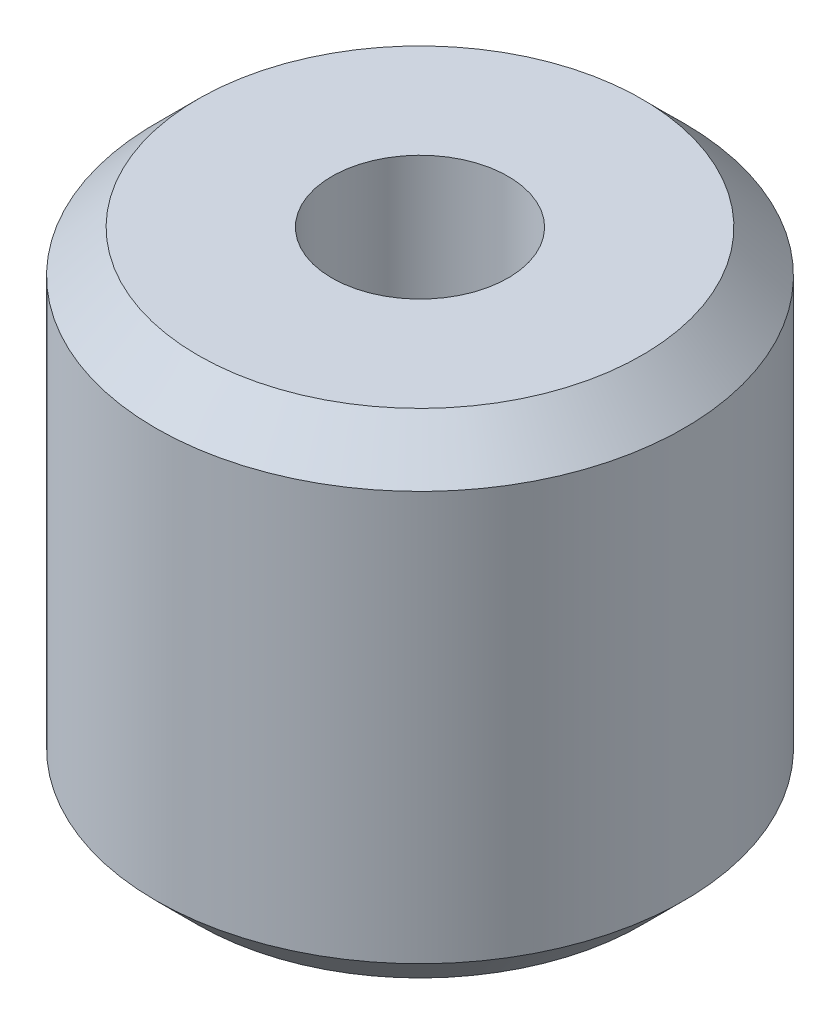
from build123d import *

# Parameters (mm, degrees)
SKETCH1_R           = 4.765
SKETCH1_R_2         = 1.59
BOSS_EXTRUDE1_DEPTH = 8.9
CHAMFER1_SIZE       = 0.76
CHAMFER2_SIZE       = 0.76


with BuildPart() as part:
    # Sketch1 → Boss-Extrude1 (new body)
    with BuildSketch(Plane(origin=(0, 0, 0), x_dir=(1, 0, 0), z_dir=(0, 1, 0))):
        with Locations(Location((0, 0, 0), (0, 0, 270))):
            Circle(SKETCH1_R)
        with Locations(Location((0, 0, 0), (0, 0, 270))):
            Circle(SKETCH1_R_2, mode=Mode.SUBTRACT)
    extrude(amount=BOSS_EXTRUDE1_DEPTH)

    # Chamfer1
    chamfer1_edges = [part.edges().sort_by_distance(p)[0] for p in [
        (0, 8.9, -4.765),
    ]]
    chamfer(chamfer1_edges, length=CHAMFER1_SIZE)

    # Chamfer2
    chamfer2_edges = [part.edges().sort_by_distance(p)[0] for p in [
        (0, 0, -4.765),
    ]]
    chamfer(chamfer2_edges, length=CHAMFER2_SIZE)


solid = part.part
